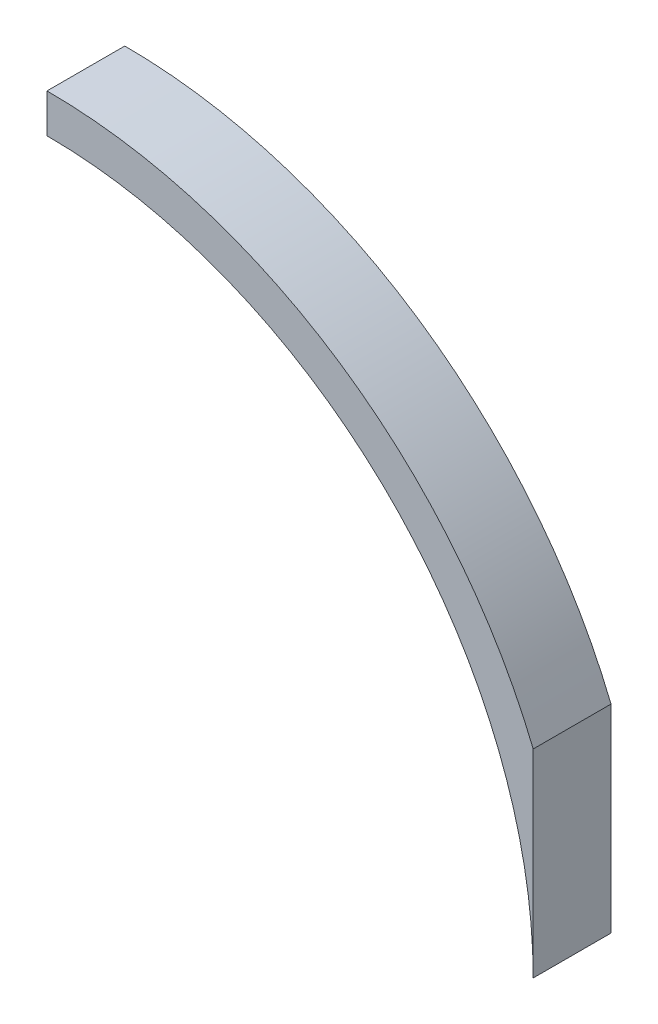
from build123d import *

# Parameters (mm, degrees)
BOSS_EXTRU_1_DEPTH           = 20
ENL_V_MAT_EXTRU_1_DEPTH      = 192.963538205
ENL_V_MAT_EXTRU_1_DEPTH_BACK = 192.963538205
ESQUISSE2_W                  = 10
ESQUISSE2_H                  = 80


with BuildPart() as part:
    # Esquisse1 → Boss.-Extru.1 (new body)
    with BuildSketch(Plane.XY):
        with BuildLine():
            Line((125, 0), (135, 0))
            ThreePointArc((135, 0), (95.45941546, 95.45941546), (0, 135))
            Line((0, 135), (0, 125))
            ThreePointArc((0, 125), (88.388347648, 88.388347648), (125, 0))
        make_face()
    extrude(amount=BOSS_EXTRU_1_DEPTH)

    # Esquisse2 → Enlèv. mat.-Extru.1 (cut, two sides: drawn at the far end of the back side and taken through both)
    with BuildSketch(Plane.XY.offset(20).offset(-ENL_V_MAT_EXTRU_1_DEPTH_BACK)):
        with Locations((130, 40)):
            Rectangle(ESQUISSE2_W, ESQUISSE2_H)
    extrude(amount=ENL_V_MAT_EXTRU_1_DEPTH + ENL_V_MAT_EXTRU_1_DEPTH_BACK, mode=Mode.SUBTRACT)


solid = part.part
